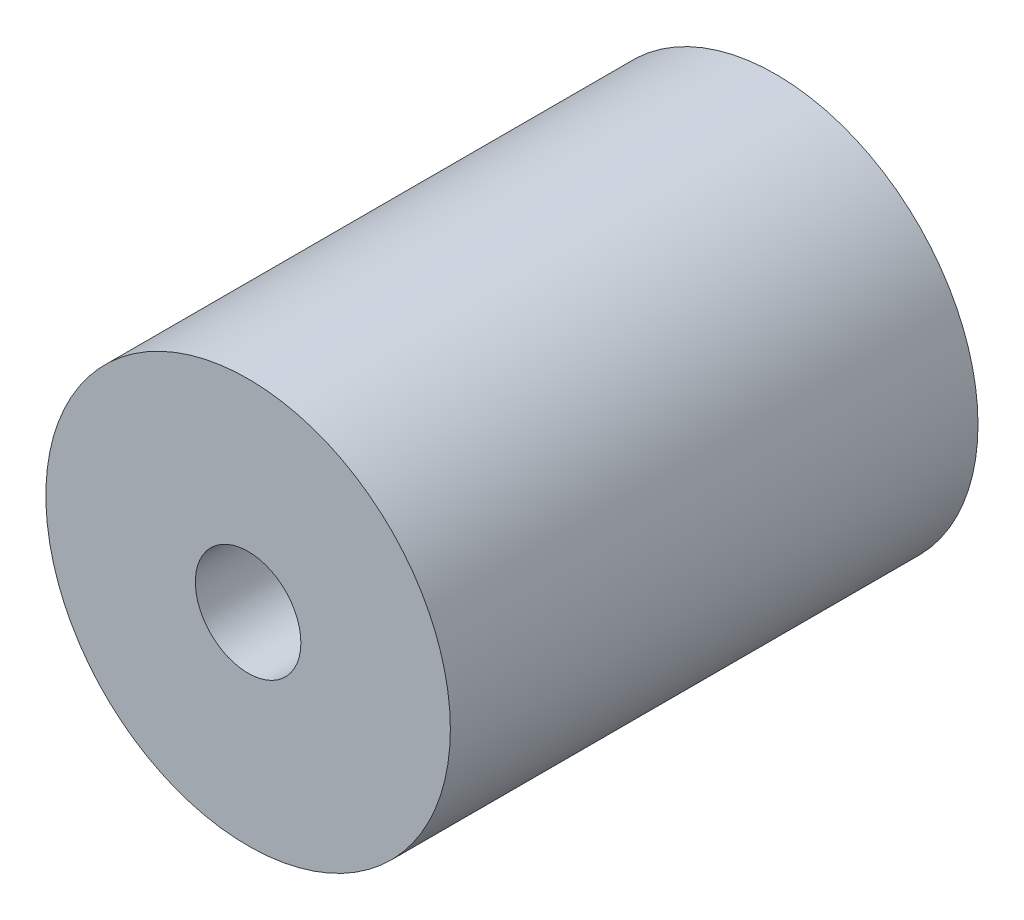
from build123d import *

# Parameters (mm, degrees)
SCHIZZO1_R                   = 11.5
SCHIZZO1_R_2                 = 3
ESTRUSIONE_ESTRUSIONE1_DEPTH = 30


with BuildPart() as part:
    # Schizzo1 → Estrusione-Estrusione1 (new body)
    with BuildSketch(Plane.XY):
        Circle(SCHIZZO1_R)
        Circle(SCHIZZO1_R_2, mode=Mode.SUBTRACT)
    extrude(amount=ESTRUSIONE_ESTRUSIONE1_DEPTH)


solid = part.part
